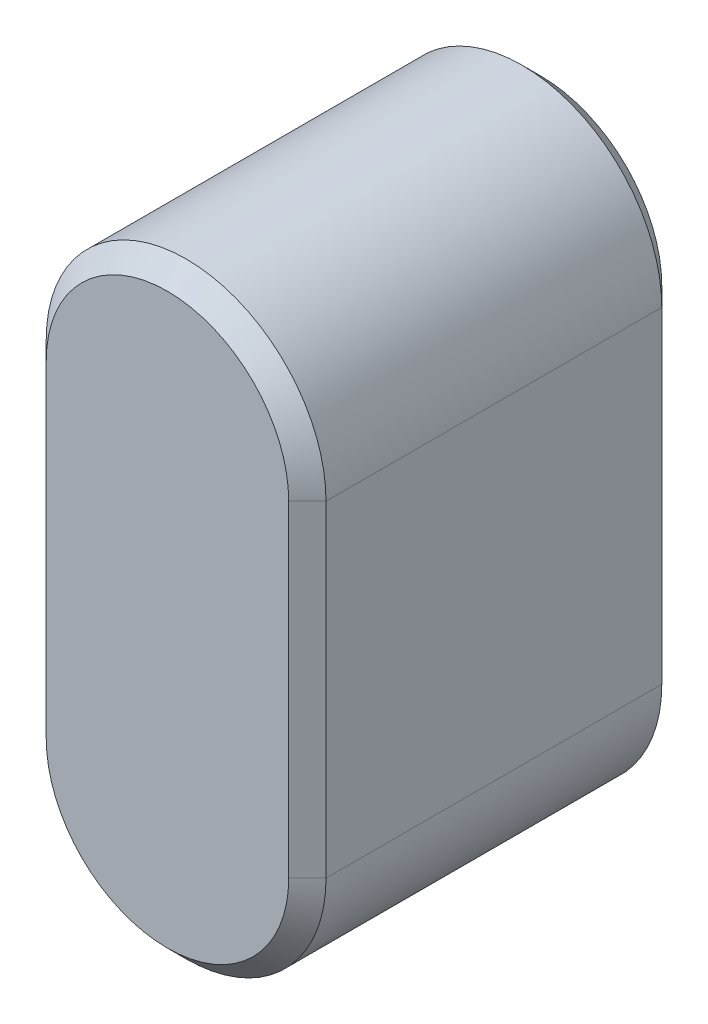
from build123d import *

# Parameters (mm, degrees)
EXTRUDE_1_DEPTH = 4
CHAMFER_1_SIZE  = 0.2


with BuildPart() as part:
    # 草图1 → 凸台-拉伸1 (new body)
    with BuildSketch(Plane.XY):
        with BuildLine():
            Line((-1.5, -1.75), (-1.5, 1.75))
            ThreePointArc((-1.5, 1.75), (0, 3.25), (1.5, 1.75))
            Line((1.5, 1.75), (1.5, -1.75))
            ThreePointArc((1.5, -1.75), (0, -3.25), (-1.5, -1.75))
        make_face()
    extrude(amount=EXTRUDE_1_DEPTH)

    # 倒角1
    chamfer_1_edges = [part.edges().sort_by_distance(p)[0] for p in [
        (0, 3.25, 4),
        (-1.5, 0, 4),
        (0, -3.25, 4),
        (-1.5, 0, 0),
        (0, 3.25, 0),
        (1.5, 0, 0),
        (0, -3.25, 0),
        (1.5, 0, 4),
    ]]
    chamfer(chamfer_1_edges, length=CHAMFER_1_SIZE)


solid = part.part
